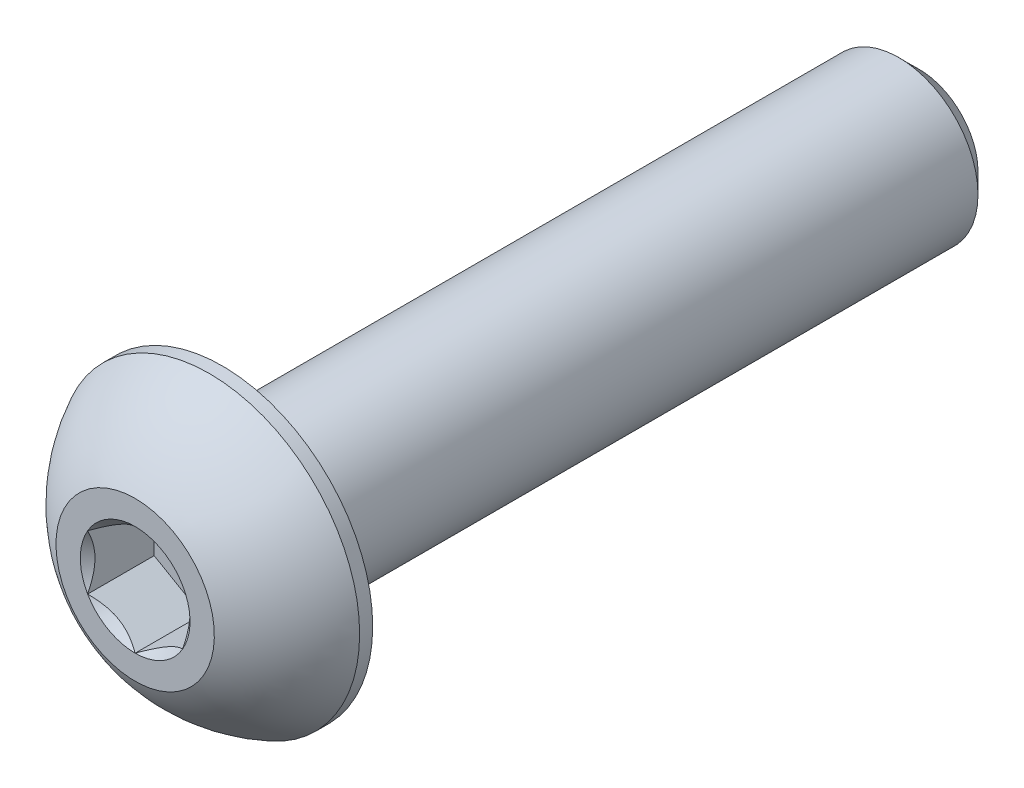
from build123d import *

# Parameters (mm, degrees)
CUT_EXTRUDE1_DEPTH = 2.1


with BuildPart() as part:
    # Sketch2 → Revolve1 (revolve)
    with BuildSketch(Plane(origin=(0, 0, 0), x_dir=(0, 0, -1), z_dir=(1, 0, 0)), mode=Mode.PRIVATE) as revolve1_sk:
        with BuildLine():
            Line((-12.375, 0), (12.375, 0))
            Line((12.375, 0), (12.375, 1.86))
            Line((12.375, 1.86), (11.735, 2.5))
            Line((11.735, 2.5), (-9.625, 2.5))
            Line((-9.625, 2.5), (-9.625, 4.75))
            Line((-9.625, 4.75), (-10.0375, 4.75))
            ThreePointArc((-10.0375, 4.75), (-11.383124817, 3.808753282), (-12.375, 2.5))
            Line((-12.375, 2.5), (-12.375, 0))
        make_face()
    revolve(revolve1_sk.sketch.rotate(Axis((0, 0, 12.375), (0, 0, -1)), 90), axis=Axis((0, 0, 12.375), (0, 0, -1)))

    # Sketch3 → Cut-Extrude1 (cut)
    with BuildSketch(Plane.XY.offset(12.375)):
        Polygon((0, 1.732050808), (-1.5, 0.866025404), (-1.5, -0.866025404), (0, -1.732050808), (1.5, -0.866025404), (1.5, 0.866025404), align=None)
    extrude(amount=-CUT_EXTRUDE1_DEPTH, mode=Mode.SUBTRACT)

    # Cut-Extrude2 cone 1 section (through the dimple's axis) → Cut-Extrude2 (revolve, cut)
    with BuildSketch(Plane(origin=(0, 0, 12.375), x_dir=(0, -1, 0), z_dir=(1, 0, 0))):
        Polygon((0, 0), (1.732050808, 0), (0, 1.732050808), align=None)
    revolve(axis=Axis((0, 0, 12.375), (0, 0, -1)), mode=Mode.SUBTRACT)


solid = part.part
